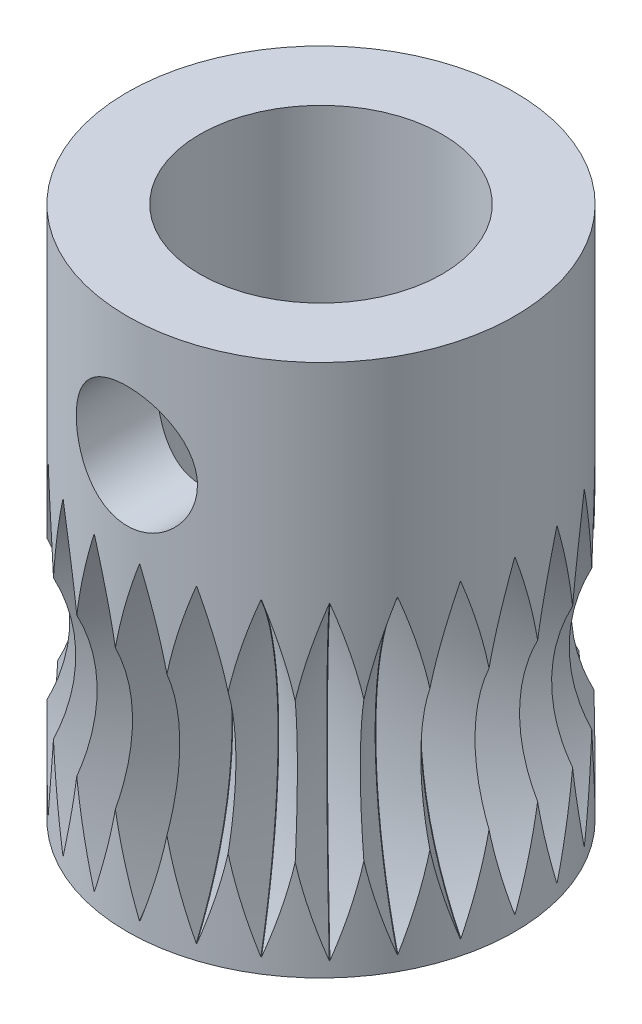
from build123d import *

# Parameters (mm, degrees)
SKETCH1_R              = 4
SKETCH1_R_2            = 2.5
BOSS_EXTRUDE1_DEPTH    = 11
M3_TAPPED_HOLE1_REACH  = 16.177
M3_TAPPED_HOLE1_BORE_R = 1.25
CIRPATTERN1_COUNT      = 25


with BuildPart() as part:
    # Sketch1 → Boss-Extrude1 (new body)
    with BuildSketch(Plane(origin=(0, 0, 0), x_dir=(1, 0, 0), z_dir=(0, 1, 0))):
        with Locations(Location((0, 0, 0), (0, 0, 270))):
            Circle(SKETCH1_R)
        with Locations(Location((0, 0, 0), (0, 0, 270))):
            Circle(SKETCH1_R_2, mode=Mode.SUBTRACT)
    extrude(amount=BOSS_EXTRUDE1_DEPTH)

    # M3 Tapped Hole1 bore → M3 Tapped Hole1 (cut, up to next)
    with BuildSketch(Plane.XY.offset(4), mode=Mode.PRIVATE) as m3_tapped_hole1_sk1:
        with Locations((0, 8.5)):
            Circle(M3_TAPPED_HOLE1_BORE_R)
    m3_tapped_hole1_tool1 = extrude(m3_tapped_hole1_sk1.sketch, amount=-M3_TAPPED_HOLE1_REACH, mode=Mode.PRIVATE) & part.part
    add(m3_tapped_hole1_tool1.solids().sort_by_distance((0, 8.5, 4))[0], mode=Mode.SUBTRACT)

    # Cut-Sweep1: sweep along a path in Sketch8
    with BuildLine(Plane.XY) as cut_sweep1_path:
        CenterArc((7.85, 3.5), 5, 0, 360)
    # Sketch10 → Cut-Sweep1 (sweep, cut)
    with BuildSketch(Plane(origin=(7.85, 0, 0), x_dir=(0, 0, -1), z_dir=(1, 0, 0))):
        Polygon((-1.619170278, 5.704175067), (1.619170278, 5.704175067), (0.005, 8.5), (-0.005, 8.5), align=None)
    cut_sweep1 = sweep(path=cut_sweep1_path.line, mode=Mode.SUBTRACT)

    # CirPattern1: Cut-Sweep1 ×25 about axis
    cirpattern1_axis = Axis((0, 11, 0), (0, -1, 0))
    for i in range(1, CIRPATTERN1_COUNT):
        add(cut_sweep1.rotate(cirpattern1_axis, i * 360 / CIRPATTERN1_COUNT), mode=Mode.SUBTRACT)


solid = part.part
